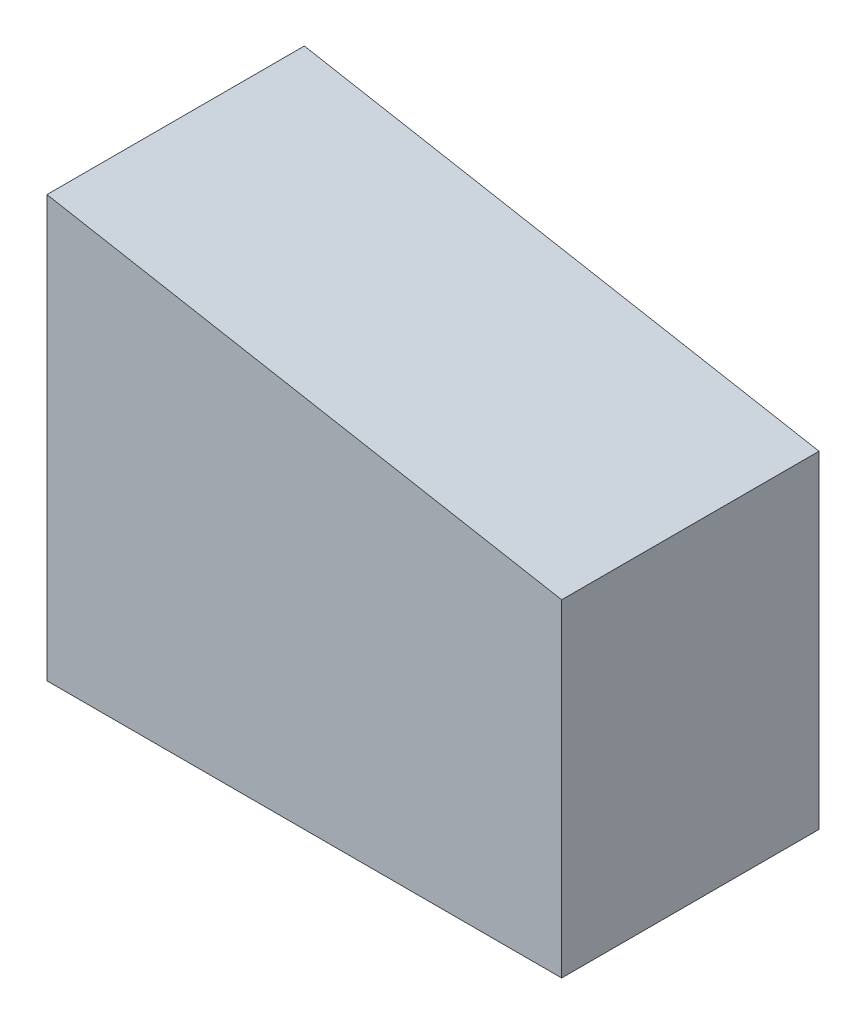
from build123d import *

# Parameters (mm, degrees)
EXTRUDE_1_DEPTH = 5.5


with BuildPart() as part:
    # ｽｹｯﾁ1 → ﾎﾞｽ - 押し出し1 (new body)
    with BuildSketch(Plane.XY):
        Polygon((0, 0), (11, 0), (11, 7), (0, 9), align=None)
    extrude(amount=EXTRUDE_1_DEPTH)


solid = part.part
